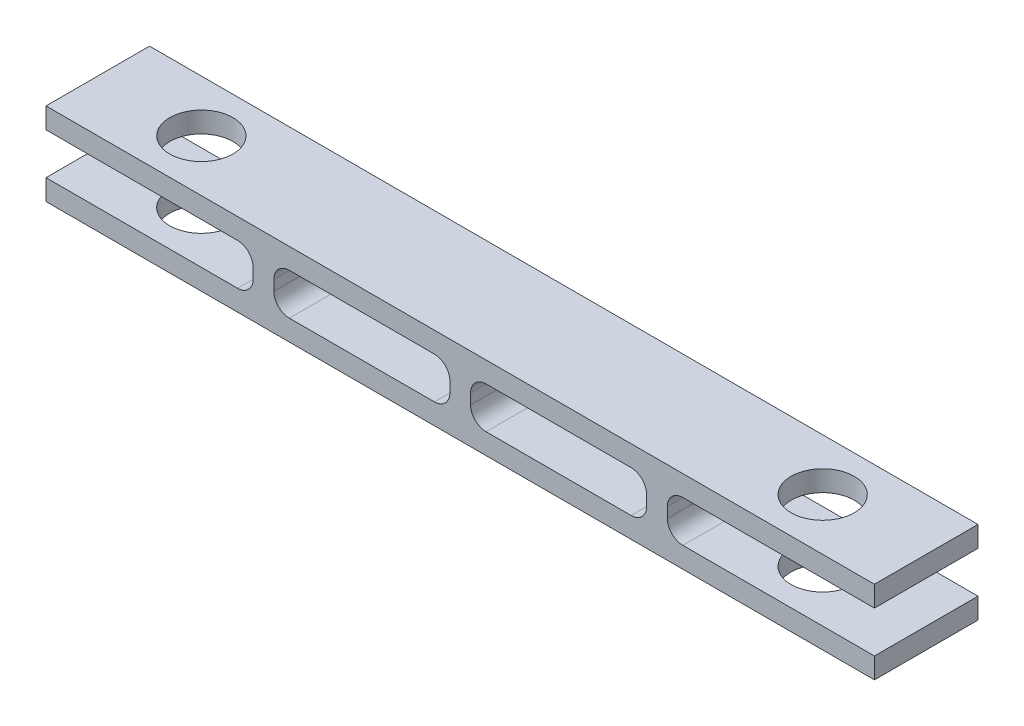
from build123d import *

# Parameters (mm, degrees)
SKETCH1_W           = 40
SKETCH1_H           = 5
BOSS_EXTRUDE1_DEPTH = 4
SKETCH2_R           = 1.525
CUT_EXTRUDE1_DEPTH  = 41.509258201
SKETCH3_W           = 10
SKETCH3_H           = 2
SKETCH3_W_2         = 8.5
CUT_EXTRUDE2_DEPTH  = 41.509258201
FILLET1_R           = 0.75


with BuildPart() as part:
    # Sketch1 → Boss-Extrude1 (new body)
    with BuildSketch(Plane(origin=(0, 0, 0), x_dir=(1, 0, 0), z_dir=(0, 1, 0))):
        with Locations((20, 2.5)):
            Rectangle(SKETCH1_W, SKETCH1_H)
    extrude(amount=BOSS_EXTRUDE1_DEPTH)

    # Sketch2 → Cut-Extrude1 (cut, through all)
    with BuildSketch(Plane(origin=(0, 4, 0), x_dir=(1, 0, 0), z_dir=(0, 1, 0))):
        with Locations(Location((5, 2.5, 0), (0, 0, 270))):
            Circle(SKETCH2_R)
        with Locations(Location((35, 2.5, 0), (0, 0, 90))):
            Circle(SKETCH2_R)
    extrude(amount=-CUT_EXTRUDE1_DEPTH, mode=Mode.SUBTRACT)

    # Sketch3 → Cut-Extrude2 (cut, through all)
    with BuildSketch(Plane(origin=(0, 0, -5), x_dir=(-1, 0, 0), z_dir=(0, 0, -1))):
        with Locations((-35, 2)):
            Rectangle(SKETCH3_W, SKETCH3_H)
        with Locations((-24.75, 2)):
            Rectangle(SKETCH3_W_2, SKETCH3_H)
        with Locations((-15.25, 2)):
            Rectangle(SKETCH3_W_2, SKETCH3_H)
        with Locations((-5, 2)):
            Rectangle(SKETCH3_W, SKETCH3_H)
    extrude(amount=-CUT_EXTRUDE2_DEPTH, mode=Mode.SUBTRACT)

    # Fillet1
    fillet1_edges = [part.edges().sort_by_distance(p)[0] for p in [
        (30, 1, -2.5),
        (30, 3, -2.5),
        (29, 1, -2.5),
        (29, 3, -2.5),
        (20.5, 3, -2.5),
        (20.5, 1, -2.5),
        (19.5, 3, -2.5),
        (11, 3, -2.5),
        (11, 1, -2.5),
        (19.5, 1, -2.5),
        (10, 3, -2.5),
        (10, 1, -2.5),
    ]]
    fillet(fillet1_edges, radius=FILLET1_R)


solid = part.part
